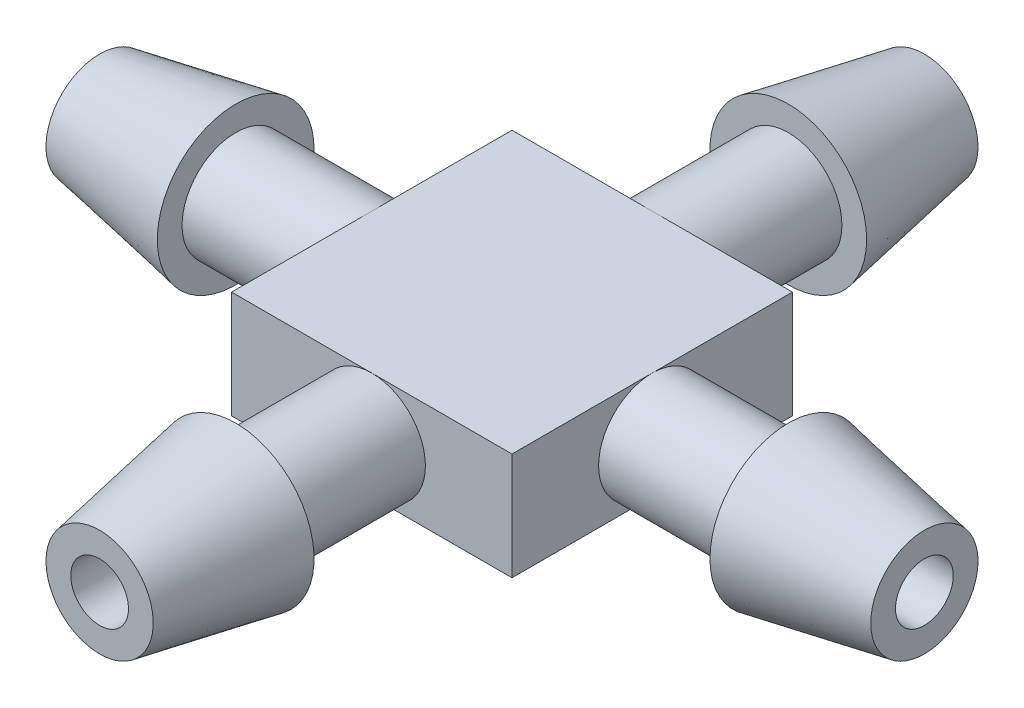
from build123d import *

# Parameters (mm, degrees)
SKETCH2_W           = 6.8
SKETCH2_H           = 2.6
SKETCH2_R           = 0.7
BOSS_EXTRUDE1_DEPTH = 6.8
CIRPATTERN2_COUNT   = 4
SKETCH3_R           = 0.7
CUT_EXTRUDE1_DEPTH  = 24.535395206


with BuildPart() as part:
    # Sketch1 → Revolve2 (revolve)
    with BuildSketch(Plane.XY):
        Polygon((7.766363636, 0.537727273), (7.766363636, 1.137727273), (4.466363636, 1.737727273), (4.466363636, 1.137727273), (1.166363636, 1.137727273), (1.166363636, 0.537727273), align=None)
    revolve2 = revolve(axis=Axis((-4.790909091, -0.162272727, 0), (1, 0, 0)))


with BuildPart() as body_2:
    # Sketch2 → Boss-Extrude1 (new body)
    with BuildSketch(Plane.ZY.offset(-1.166363636)):
        with Locations((0, -0.162272727)):
            Rectangle(SKETCH2_W, SKETCH2_H)
        with Locations((0, -0.162272727)):
            Circle(SKETCH2_R, mode=Mode.SUBTRACT)
    extrude(amount=BOSS_EXTRUDE1_DEPTH)

    # CirPattern2: Revolve2 ×4 about axis
    cirpattern2_axis = Axis((-2.233636364, 1.267727273, 0), (0, -1, 0))
    for i in range(1, CIRPATTERN2_COUNT):
        add(revolve2.rotate(cirpattern2_axis, i * 360 / CIRPATTERN2_COUNT))

    # Sketch3 → Cut-Extrude1 (cut, through all)
    with BuildSketch(Plane(origin=(0, 0, -10), x_dir=(-1, 0, 0), z_dir=(0, 0, -1))):
        with Locations((2.233636364, -0.162272727)):
            Circle(SKETCH3_R)
    extrude(amount=-CUT_EXTRUDE1_DEPTH, mode=Mode.SUBTRACT)


solid = Compound([part.part, body_2.part])
